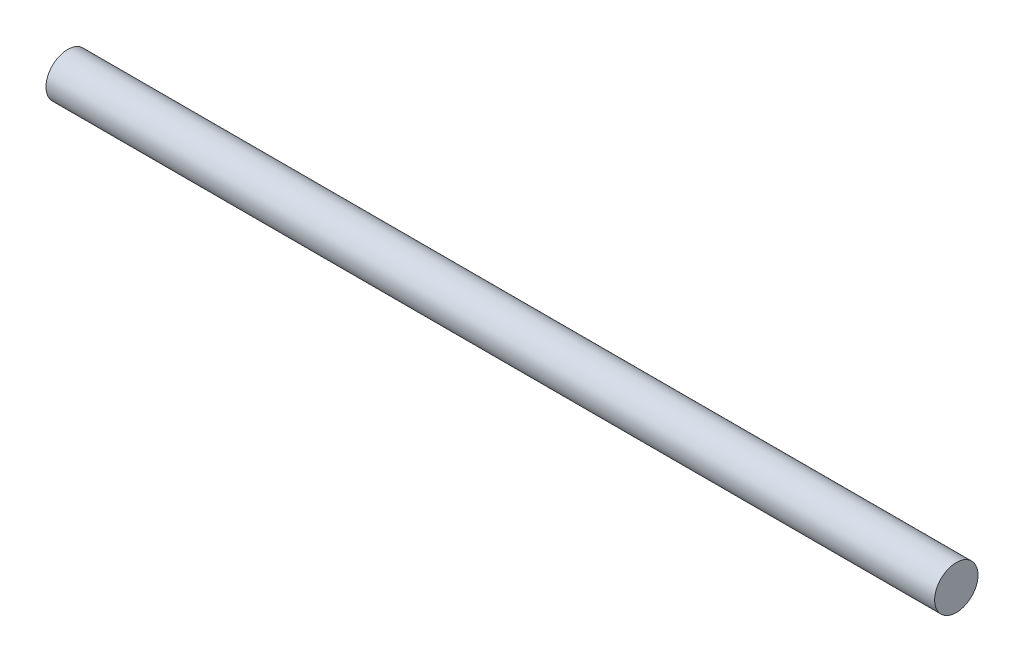
from build123d import *

# Parameters (mm, degrees)
SKETCH1_R           = 21.082
BOSS_EXTRUDE1_DEPTH = 863.6


with BuildPart() as part:
    # Sketch1 → Boss-Extrude1 (new body)
    with BuildSketch(Plane(origin=(0, 0, 0), x_dir=(0, 0, -1), z_dir=(1, 0, 0))):
        Circle(SKETCH1_R)
    extrude(amount=BOSS_EXTRUDE1_DEPTH)


solid = part.part
